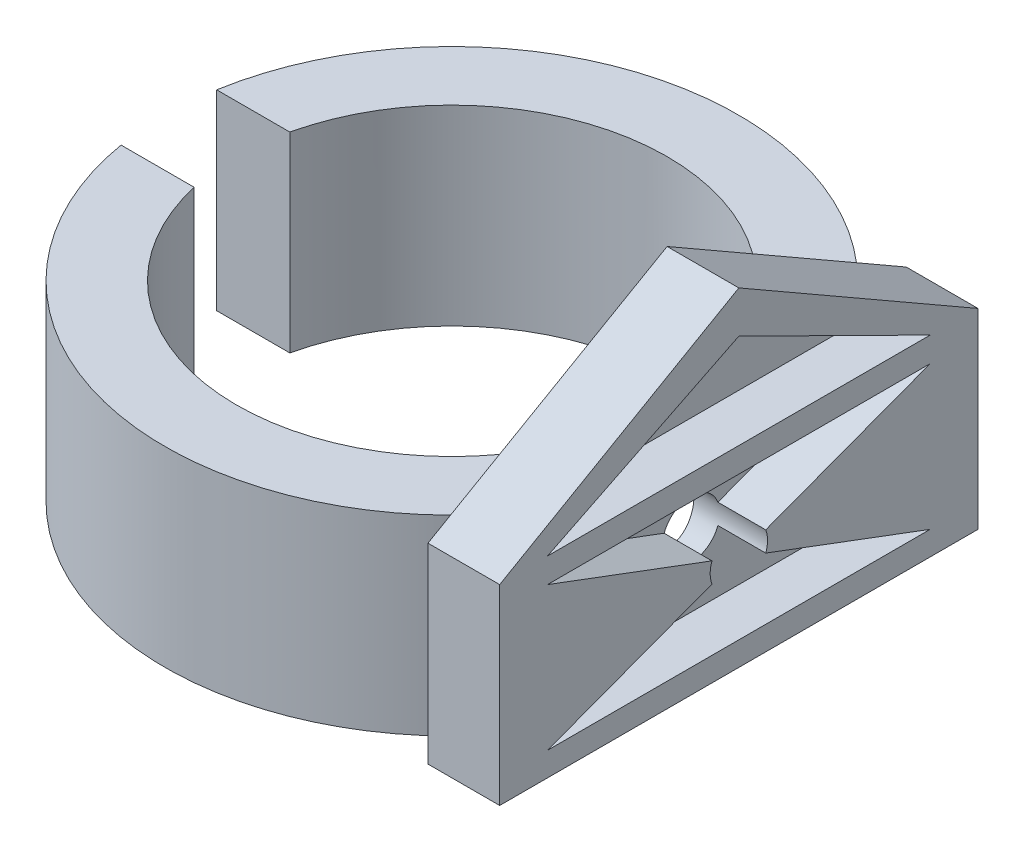
from build123d import *

# Parameters (mm, degrees)
SKETCH1_R           = 30
SKETCH1_R_2         = 22.5
BOSS_EXTRUDE1_DEPTH = 20
SKETCH2_W           = 50
SKETCH2_H           = 20
BOSS_EXTRUDE2_DEPTH = 7.5
SKETCH4_W           = 14.39860727
SKETCH4_H           = 10
CUT_EXTRUDE1_DEPTH  = 20
CUT_EXTRUDE3_DEPTH  = 5
SKETCH8_R           = 3
CUT_EXTRUDE4_DEPTH  = 10
BOSS_EXTRUDE3_DEPTH = 7.5
CUT_EXTRUDE5_DEPTH  = 5


with BuildPart() as part:
    # Sketch1 → Boss-Extrude1 (new body)
    with BuildSketch(Plane(origin=(0, 0, 0), x_dir=(1, 0, 0), z_dir=(0, 1, 0))):
        with Locations(Location((0, 0, 0), (0, 0, 270))):
            Circle(SKETCH1_R)
        with Locations(Location((0, 0, 0), (0, 0, 270))):
            Circle(SKETCH1_R_2, mode=Mode.SUBTRACT)
    extrude(amount=BOSS_EXTRUDE1_DEPTH)

    # Sketch2 → Boss-Extrude2 (add)
    with BuildSketch(Plane(origin=(22.5, 0, 0), x_dir=(0, 0, -1), z_dir=(1, 0, 0))):
        with Locations((0, 10)):
            Rectangle(SKETCH2_W, SKETCH2_H)
    extrude(amount=BOSS_EXTRUDE2_DEPTH)

    # Sketch4 → Cut-Extrude1 (cut)
    with BuildSketch(Plane(origin=(0, 0, 0), x_dir=(1, 0, 0), z_dir=(0, 1, 0))):
        with Locations((-26.790895642, 0)):
            Rectangle(SKETCH4_W, SKETCH4_H)
    extrude(amount=CUT_EXTRUDE1_DEPTH, mode=Mode.SUBTRACT)

    # Sketch7 → Cut-Extrude3 (cut)
    with BuildSketch(Plane(origin=(30, 0, 0), x_dir=(0, 0, -1), z_dir=(1, 0, 0))):
        Polygon((-1, 9.625), (-20, 2.5), (20, 2.5), (1, 9.625), (1, 10.375), (20, 17.5), (-20, 17.5), (-1, 10.375), align=None)
    extrude(amount=-CUT_EXTRUDE3_DEPTH, mode=Mode.SUBTRACT)

    # Sketch8 → Cut-Extrude4 (cut)
    with BuildSketch(Plane(origin=(30, 0, 0), x_dir=(0, 0, -1), z_dir=(1, 0, 0))):
        with Locations((0, 10)):
            Circle(SKETCH8_R)
    extrude(amount=-CUT_EXTRUDE4_DEPTH, mode=Mode.SUBTRACT)

    # Sketch9 → Boss-Extrude3 (add)
    with BuildSketch(Plane(origin=(30, 0, 0), x_dir=(0, 0, -1), z_dir=(1, 0, 0))):
        Polygon((-25, 20), (0, 34.357764991), (25, 20), align=None)
    extrude(amount=-BOSS_EXTRUDE3_DEPTH)

    # Sketch10 → Cut-Extrude5 (cut)
    with BuildSketch(Plane(origin=(30, 0, 0), x_dir=(0, 0, -1), z_dir=(1, 0, 0))):
        Polygon((-20, 20.088403301), (20, 20.088403301), (0, 29.990964176), align=None)
    extrude(amount=-CUT_EXTRUDE5_DEPTH, mode=Mode.SUBTRACT)


solid = part.part
